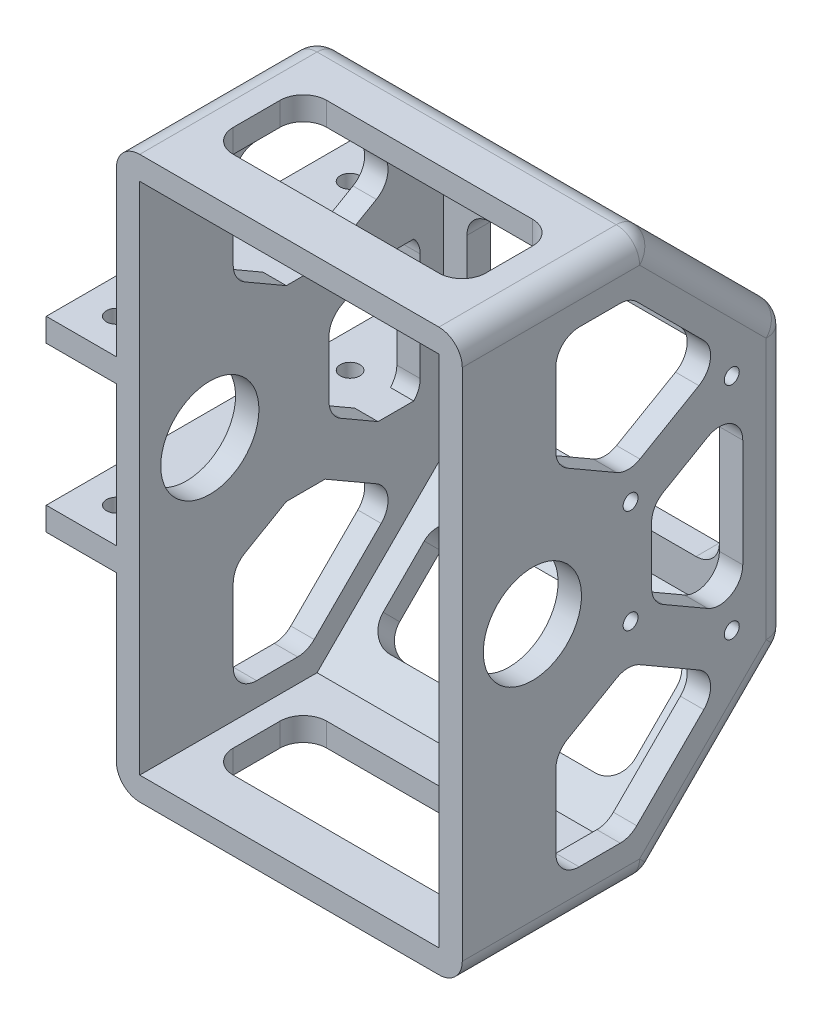
from build123d import *

# Parameters (mm, degrees)
SKETCH_1_W           = 74
SKETCH_1_H           = 120
EXTRUDE_1_DEPTH      = 70
CHAMFER_2_SIZE       = 30
SHELL_1_T            = -5
CUT_EXTRUDE_1_DEPTH  = 119.220133649
SKETCH_3_W           = 54
SKETCH_3_H           = 22.426406871
CUT_EXTRUDE_2_DEPTH  = 70
SKETCH_4_W           = 54
SKETCH_4_H           = 22.426406871
CUT_EXTRUDE_3_DEPTH  = 70
SKETCH_5_W           = 54
SKETCH_5_H           = 40
CUT_EXTRUDE_4_DEPTH  = 70
SKETCH_7_W           = 54
SKETCH_7_H           = 20
CUT_EXTRUDE_5_DEPTH  = 144.767172887
FILLET_1_R           = 5
EXTRUDE_3_DEPTH      = 15
EXTRUDE_3_DEPTH_BACK = 5
SKETCH_10_W          = 70
SKETCH_10_H          = 5
SKETCH_12_R          = 2.1
CUT_EXTRUDE_7_DEPTH  = 119.33849754
SKETCH_13_R          = 1.6
CUT_EXTRUDE_8_DEPTH  = 10


with BuildPart() as part:
    # ｽｹｯﾁ1 → ﾎﾞｽ - 押し出し1 (new body)
    with BuildSketch(Plane.XY):
        Rectangle(SKETCH_1_W, SKETCH_1_H)
    extrude(amount=EXTRUDE_1_DEPTH)

    # 面取り2
    chamfer_2_edges = [part.edges().sort_by_distance(p)[0] for p in [
        (0, -60, 0),
        (0, 60, 0),
    ]]
    chamfer(chamfer_2_edges, length=CHAMFER_2_SIZE)

    # ｼｪﾙ1
    shell_1_openings = [part.faces().sort_by_distance(p)[0] for p in [
        (0, 0, 70),
    ]]
    offset(amount=SHELL_1_T, openings=shell_1_openings, kind=Kind.INTERSECTION)

    # ｽｹｯﾁ2 → ｶｯﾄ - 押し出し1 (cut, through all)
    with BuildSketch(Plane.ZY.offset(37)):
        Polygon((34.142135624, -50), (50, -50), (50, -26.558112383), (34.5, -17.60918321), (13.738168081, -29.596032457), align=None)
        Polygon((10, 20.207259422), (10, -20.207259422), (29.5, -8.948929172), (29.5, 8.948929172), align=None)
        Polygon((34.142135624, 50), (13.738168081, 29.596032457), (34.5, 17.60918321), (50, 26.558112383), (50, 50), align=None)
        with BuildLine():
            ThreePointArc((60, 9.233092656), (44.5, 0), (60, -9.233092656))
            Line((60, -9.233092656), (60, 9.233092656))
        make_face()
        with BuildLine():
            Line((60, 9.233092656), (60, -9.233092656))
            ThreePointArc((60, -9.233092656), (64.020809276, -5.373546315), (65.5, 0))
            ThreePointArc((65.5, 0), (64.020809276, 5.373546315), (60, 9.233092656))
        make_face()
    extrude(amount=-CUT_EXTRUDE_1_DEPTH, mode=Mode.SUBTRACT)

    # ｽｹｯﾁ3 → ｶｯﾄ - 押し出し2 (cut)
    with BuildSketch(Plane(origin=(0, -15, -15), x_dir=(1, 0, 0), z_dir=(0, -0.7071067811865464, -0.7071067811865487))):
        with Locations((0, 42.426406872)):
            Rectangle(SKETCH_3_W, SKETCH_3_H)
    extrude(amount=-CUT_EXTRUDE_2_DEPTH, mode=Mode.SUBTRACT)

    # ｽｹｯﾁ4 → ｶｯﾄ - 押し出し3 (cut)
    with BuildSketch(Plane(origin=(0, 15, -15), x_dir=(1, 0, 0), z_dir=(0, 0.7071067811865464, -0.7071067811865487))):
        with Locations((0, -42.426406872)):
            Rectangle(SKETCH_4_W, SKETCH_4_H)
    extrude(amount=-CUT_EXTRUDE_3_DEPTH, mode=Mode.SUBTRACT)

    # ｽｹｯﾁ5 → ｶｯﾄ - 押し出し4 (cut)
    with BuildSketch(Plane(origin=(0, 0, 0), x_dir=(-1, 0, 0), z_dir=(0, 0, -1))):
        Rectangle(SKETCH_5_W, SKETCH_5_H)
    extrude(amount=-CUT_EXTRUDE_4_DEPTH, mode=Mode.SUBTRACT)

    # ｽｹｯﾁ7 → ｶｯﾄ - 押し出し5 (cut, through all)
    with BuildSketch(Plane(origin=(0, 60, 0), x_dir=(1, 0, 0), z_dir=(0, 1, 0))):
        with Locations((0, -50)):
            Rectangle(SKETCH_7_W, SKETCH_7_H)
    extrude(amount=-CUT_EXTRUDE_5_DEPTH, mode=Mode.SUBTRACT)

    # ﾌｨﾚｯﾄ1
    fillet_1_edges = [part.edges().sort_by_distance(p)[0] for p in [
        (34.5, 20.207259422, 10),
        (34.5, 8.948929172, 29.5),
        (34.5, -8.948929172, 29.5),
        (34.5, -20.207259422, 10),
        (-34.5, 20.207259422, 10),
        (-34.5, 8.948929172, 29.5),
        (-34.5, -8.948929172, 29.5),
        (-34.5, -20.207259422, 10),
        (0, 60, 30),
        (-27, -51.161165235, 24.696699141),
        (27, -51.161165235, 24.696699141),
        (27, -35.303300859, 8.838834765),
        (-27, -35.303300859, 8.838834765),
        (-37, 0, 0),
        (-37, -45, 15),
        (-37, 45, 15),
        (27, 51.161165235, 24.696699141),
        (-27, 51.161165235, 24.696699141),
        (-27, 35.303300859, 8.838834765),
        (27, 35.303300859, 8.838834765),
        (37, 0, 0),
        (0, -30, 0),
        (0, 30, 0),
        (37, -45, 15),
        (-27, -20, 2.5),
        (27, -20, 2.5),
        (27, 20, 2.5),
        (-27, 20, 2.5),
        (37, 45, 15),
        (0, -60, 30),
        (27, 57.5, 60),
        (-27, 57.5, 60),
        (-27, 57.5, 40),
        (27, 57.5, 40),
        (27, -57.5, 60),
        (-27, -57.5, 60),
        (-27, -57.5, 40),
        (27, -57.5, 40),
        (34.5, -50, 34.142135624),
        (34.5, -29.596032457, 13.738168081),
        (34.5, -17.60918321, 34.5),
        (34.5, -26.558112383, 50),
        (34.5, -50, 50),
        (-34.5, -50, 34.142135624),
        (-34.5, -29.596032457, 13.738168081),
        (-34.5, -17.60918321, 34.5),
        (-34.5, -26.558112383, 50),
        (-34.5, -50, 50),
        (37, -60, 50),
        (-37, -60, 50),
        (-37, 60, 50),
        (37, 60, 50),
        (34.5, 50, 34.142135624),
        (34.5, 50, 50),
        (34.5, 26.558112383, 50),
        (34.5, 17.60918321, 34.5),
        (34.5, 29.596032457, 13.738168081),
        (-34.5, 50, 34.142135624),
        (-34.5, 50, 50),
        (-34.5, 26.558112383, 50),
        (-34.5, 17.60918321, 34.5),
        (-34.5, 29.596032457, 13.738168081),
    ]]
    fillet(fillet_1_edges, radius=FILLET_1_R)

    # ｽｹｯﾁ10 → ﾎﾞｽ - 押し出し3 (add, two sides: drawn at the far end of the back side and taken through both)
    with BuildSketch(Plane.ZY.offset(37).offset(-EXTRUDE_3_DEPTH_BACK)):
        with Locations((35, 17.5)):
            Rectangle(SKETCH_10_W, SKETCH_10_H)
        with Locations((35, -17.5)):
            Rectangle(SKETCH_10_W, SKETCH_10_H)
    extrude(amount=EXTRUDE_3_DEPTH + EXTRUDE_3_DEPTH_BACK)

    # ｽｹｯﾁ12 → ｶｯﾄ - 押し出し7 (cut, through all)
    with BuildSketch(Plane.XZ.offset(20)):
        with Locations((-44.5, 62.5)):
            Circle(SKETCH_12_R)
        with Locations((-44.5, 12.5)):
            Circle(SKETCH_12_R)
    extrude(amount=-CUT_EXTRUDE_7_DEPTH, mode=Mode.SUBTRACT)

    # ｽｹｯﾁ13 → ｶｯﾄ - 押し出し8 (cut)
    with BuildSketch(Plane(origin=(37, 0, 0), x_dir=(0, 0, -1), z_dir=(1, 0, 0))):
        with Locations(Location((-12.349364905, 24.624355653, 0), (0, 0, 90))):
            Circle(SKETCH_13_R)
        with Locations(Location((-34, 12.124355653, 0), (0, 0, 90))):
            Circle(SKETCH_13_R)
        with Locations(Location((-34, -10.011106999, 0), (0, 0, 90))):
            Circle(SKETCH_13_R)
        with Locations(Location((-12.349364905, -22.511106999, 0), (0, 0, 90))):
            Circle(SKETCH_13_R)
    extrude(amount=-CUT_EXTRUDE_8_DEPTH, mode=Mode.SUBTRACT)


solid = part.part
